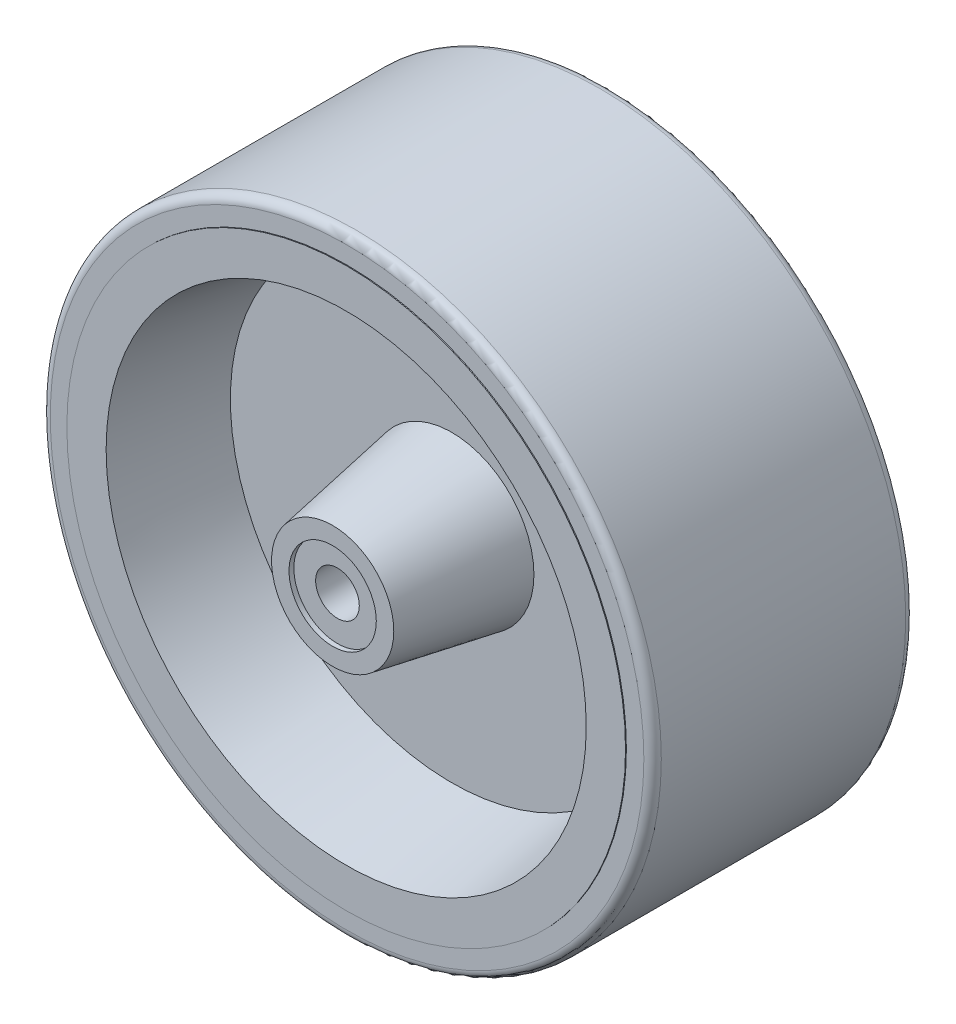
from build123d import *

# Parameters (mm, degrees)
SKETCH1_R           = 88.9
SKETCH1_R_2         = 78.74
BOSS_EXTRUDE1_DEPTH = 38.1
FILLET1_R           = 2.54
SKETCH8_R           = 6.35
CUT_EXTRUDE1_DEPTH  = 151.751995817


with BuildPart() as part:
    # Sketch1 → Boss-Extrude1 (new, symmetric)
    with BuildSketch(Plane.XY):
        with Locations(Location((0, 0, 0), (0, 0, 180))):
            Circle(SKETCH1_R)
        with Locations(Location((0, 0, 0), (0, 0, 180))):
            Circle(SKETCH1_R_2, mode=Mode.SUBTRACT)
    extrude(amount=BOSS_EXTRUDE1_DEPTH, both=True)

    # Fillet1
    fillet1_edges = [part.edges().sort_by_distance(p)[0] for p in [
        (88.9, 0, -38.1),
        (88.9, 0, 38.1),
    ]]
    fillet(fillet1_edges, radius=FILLET1_R)


with BuildPart() as body_2:
    # Sketch3 → Revolve1 (revolve)
    with BuildSketch(Plane(origin=(0, 0, 0), x_dir=(1, 0, 0), z_dir=(0, 1, 0)), mode=Mode.PRIVATE) as revolve1_sk:
        Polygon((0, 40.894), (0, -40.894), (-12.7, -40.894), (-12.7, -42.291), (-17.78, -42.291), (-23.893432748, -7.62), (-64.430766575, -7.62), (-69.85, -38.354), (-81.28, -38.354), (-81.28, 38.354), (-69.85, 38.354), (-64.430766575, 7.62), (-23.893432748, 7.62), (-17.78, 42.291), (-12.7, 42.291), (-12.7, 40.894), align=None)
    revolve(revolve1_sk.sketch.rotate(Axis((0, 0, 0), (0, 0, -1)), 180), axis=Axis((0, 0, 0), (0, 0, -1)))

    # Sketch8 → Cut-Extrude1 (cut, through all)
    with BuildSketch(Plane.XY.offset(40.894)):
        Circle(SKETCH8_R)
    extrude(amount=-CUT_EXTRUDE1_DEPTH, mode=Mode.SUBTRACT)


solid = Compound([part.part, body_2.part])
